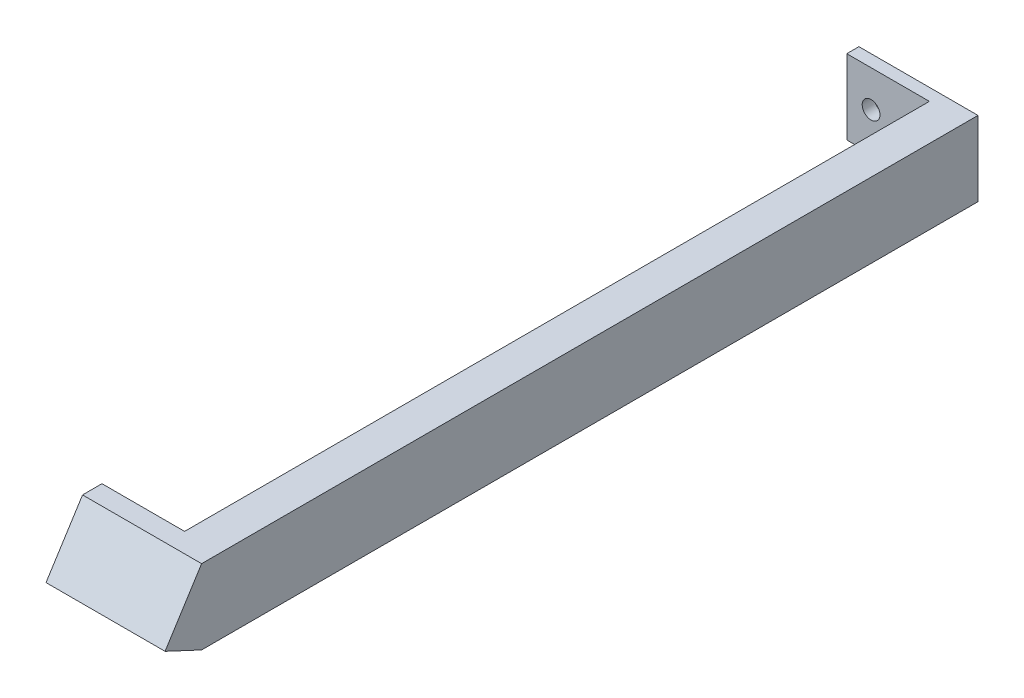
from build123d import *

# Parameters (mm, degrees)
BOSS_EXTRUDE1_DEPTH = 49
SKETCH2_W           = 306.472298026
SKETCH2_H           = 30.75390082
CUT_EXTRUDE1_DEPTH  = 34
SKETCH4_R           = 3.65
CUT_EXTRUDE2_DEPTH  = 10


with BuildPart() as part:
    # Sketch1 → Boss-Extrude1 (new body)
    with BuildSketch(Plane(origin=(0, 0, 0), x_dir=(0, 0, -1), z_dir=(1, 0, 0))):
        Polygon((-375.84656477, -0.209706312), (-390.875399113, -23.945501074), (-375.84656477, -30.963607132), (-56.374266744, -30.963607132), (-56.374266744, -0.209706312), align=None)
    extrude(amount=BOSS_EXTRUDE1_DEPTH)

    # Sketch2 → Cut-Extrude1 (cut)
    with BuildSketch(Plane.ZY):
        with Locations((214.610415757, -15.586656722)):
            Rectangle(SKETCH2_W, SKETCH2_H)
    extrude(amount=-CUT_EXTRUDE1_DEPTH, mode=Mode.SUBTRACT)

    # Sketch4 → Cut-Extrude2 (cut)
    with BuildSketch(Plane(origin=(0, 0, 56.374266744), x_dir=(-1, 0, 0), z_dir=(0, 0, -1))):
        with Locations((-10, -15.209706312)):
            Circle(SKETCH4_R)
    extrude(amount=-CUT_EXTRUDE2_DEPTH, mode=Mode.SUBTRACT)


solid = part.part
